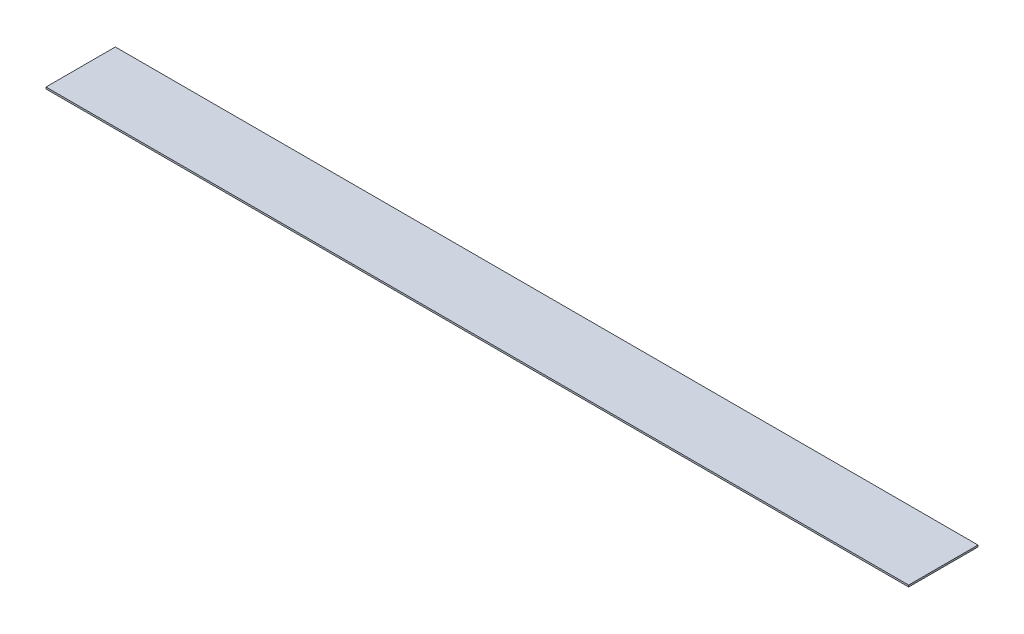
from build123d import *

# Parameters (mm, degrees)
BOSS_EXTRUDE1_DEPTH      = 790
BOSS_EXTRUDE1_DEPTH_BACK = 790
SKETCH3_W                = 127
SKETCH3_H                = 3.175


with BuildPart() as part:
    # Sketch3 → Boss-Extrude1 (new, two sides: drawn at the far end of the back side and taken through both)
    with BuildSketch(Plane(origin=(0, 0, 0), x_dir=(0, 0, -1), z_dir=(1, 0, 0)).offset(-BOSS_EXTRUDE1_DEPTH_BACK)):
        Rectangle(SKETCH3_W, SKETCH3_H)
    extrude(amount=BOSS_EXTRUDE1_DEPTH + BOSS_EXTRUDE1_DEPTH_BACK)


solid = part.part
